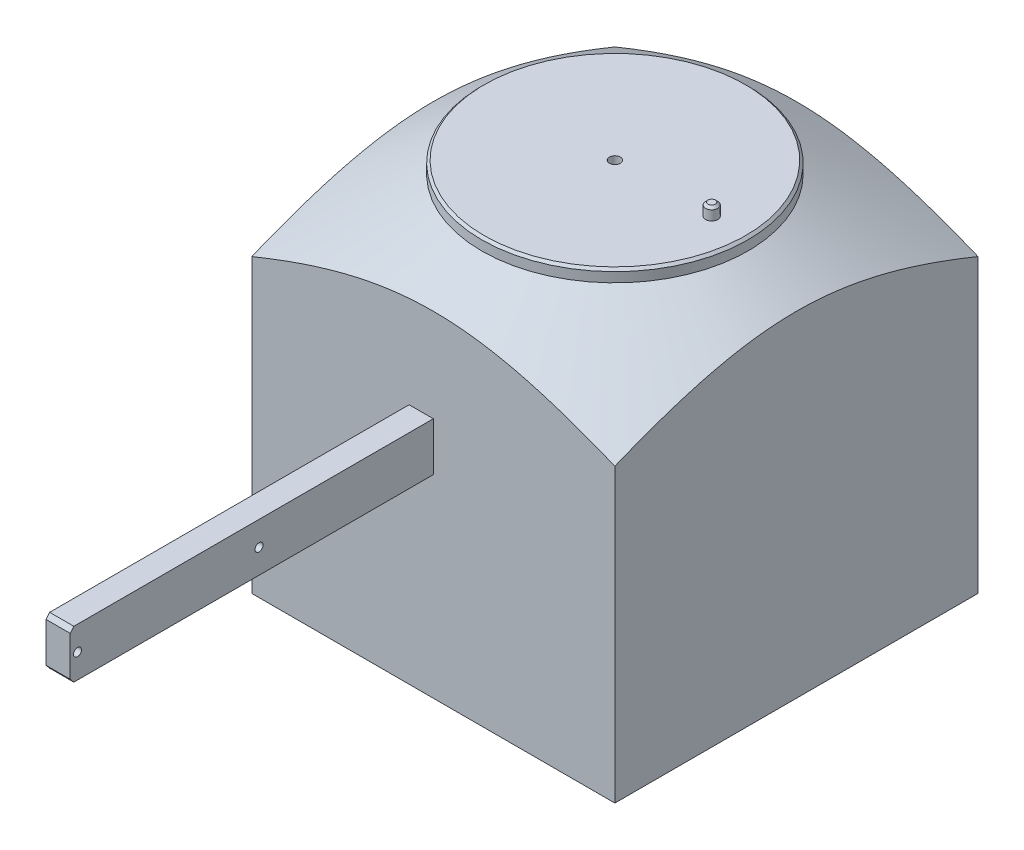
from build123d import *
from OCP.BRepFilletAPI import BRepFilletAPI_MakeChamfer

# Parameters (mm, degrees)
SKETCH1_W                  = 300
SKETCH1_H                  = 300
BOSS_EXTRUDE1_DEPTH        = 300
SKETCH3_R                  = 110
BOSS_EXTRUDE2_DEPTH        = 10
SKETCH4_R                  = 5
BOSS_EXTRUDE3_DEPTH        = 10
CHAMFER1_SIZE              = 2
CHAMFER2_SIZE              = 2
M10X1_0_TAPPED_HOLE1_D     = 9
M10X1_0_TAPPED_HOLE1_DEPTH = 23
M10X1_0_TAPPED_HOLE1_TIP   = 2.703872786
SKETCH7_W                  = 20
SKETCH7_H                  = 40
BOSS_EXTRUDE4_DEPTH        = 300
CHAMFER3_SIZE              = 3
CHAMFER3_SIZE2             = 3.575260778
M6_CLEARANCE_HOLE1_D       = 6.6


with BuildPart() as part:
    # Sketch1 → Boss-Extrude1 (new body)
    with BuildSketch(Plane(origin=(0, 0, 0), x_dir=(1, 0, 0), z_dir=(0, 1, 0))):
        Rectangle(SKETCH1_W, SKETCH1_H)
    extrude(amount=BOSS_EXTRUDE1_DEPTH)

    # Sketch2 → Cut-Revolve1 (revolve, cut)
    with BuildSketch(Plane.XY, mode=Mode.PRIVATE) as cut_revolve1_sk:
        Polygon((110, 300), (250, 219.170962313), (250, 300), align=None)
    revolve(cut_revolve1_sk.sketch.rotate(Axis((0, 394.192122867, 0), (0, -1, 0)), 314.999999708), axis=Axis((0, 394.192122867, 0), (0, -1, 0)), mode=Mode.SUBTRACT)

    # Sketch3 → Boss-Extrude2 (add)
    with BuildSketch(Plane(origin=(0, 300, 0), x_dir=(1, 0, 0), z_dir=(0, 1, 0))):
        with Locations(Location((0, 0, 0), (0, 0, 270))):
            Circle(SKETCH3_R)
    extrude(amount=BOSS_EXTRUDE2_DEPTH)

    # Sketch4 → Boss-Extrude3 (add)
    with BuildSketch(Plane(origin=(0, 310, 0), x_dir=(1, 0, 0), z_dir=(0, 1, 0))):
        with Locations(Location((80, 0, 0), (0, 0, 270))):
            Circle(SKETCH4_R)
    extrude(amount=BOSS_EXTRUDE3_DEPTH)

    # Chamfer1
    chamfer1_edges = [part.edges().sort_by_distance(p)[0] for p in [
        (0, 310, -110),
    ]]
    chamfer(chamfer1_edges, length=CHAMFER1_SIZE)

    # Chamfer2
    chamfer2_edges = [part.edges().sort_by_distance(p)[0] for p in [
        (80, 320, -5),
    ]]
    chamfer(chamfer2_edges, length=CHAMFER2_SIZE)

    # M10x1.0 Tapped Hole1
    with Locations(Plane(origin=(0, 310, 0), x_dir=(1, 0, 0), z_dir=(0, 1, 0))):
        with Locations((0, 0)):
            Hole(M10X1_0_TAPPED_HOLE1_D / 2, depth=M10X1_0_TAPPED_HOLE1_DEPTH)
            with Locations((0, 0, -(M10X1_0_TAPPED_HOLE1_DEPTH + M10X1_0_TAPPED_HOLE1_TIP / 2))):  # 118° drill point
                Cone(0, M10X1_0_TAPPED_HOLE1_D / 2, M10X1_0_TAPPED_HOLE1_TIP, mode=Mode.SUBTRACT)

    # Sketch7 → Boss-Extrude4 (add)
    with BuildSketch(Plane.XY.offset(150)):
        with Locations((-10, 180)):
            Rectangle(SKETCH7_W, SKETCH7_H)
    extrude(amount=BOSS_EXTRUDE4_DEPTH)

    # Chamfer3: one chamfer whose edges measure the first distance from different faces: ONE call of the kernel's chamfer builder (chamfer() names one face for all edges)
    chamfer3_edges_1 = [part.edges().sort_by_distance(p)[0] for p in [
        (-10, 200, 450),
    ]]
    chamfer3_side_1 = [part.faces().sort_by_distance(p)[0] for p in [
        (-10, 200, 300),
    ]]
    chamfer3_edges_2 = [part.edges().sort_by_distance(p)[0] for p in [
        (-10, 160, 450),
    ]]
    chamfer3_side_2 = [part.faces().sort_by_distance(p)[0] for p in [
        (-10, 160, 300),
    ]]
    chamfer3 = BRepFilletAPI_MakeChamfer(part.part.solid().wrapped)
    for e in chamfer3_edges_1:
        chamfer3.Add(CHAMFER3_SIZE, CHAMFER3_SIZE2, e.wrapped, chamfer3_side_1[0].wrapped)  # the first distance lies on this face
    for e in chamfer3_edges_2:
        chamfer3.Add(CHAMFER3_SIZE, CHAMFER3_SIZE2, e.wrapped, chamfer3_side_2[0].wrapped)  # the first distance lies on this face
    add(Compound.cast(chamfer3.Shape()), mode=Mode.REPLACE)

    # M6 Clearance Hole1 (through all)
    with Locations(Plane(origin=(0, 0, 0), x_dir=(0, 0, -1), z_dir=(1, 0, 0))):
        with Locations((-444, 180), (-294, 180)):
            Hole(M6_CLEARANCE_HOLE1_D / 2)


solid = part.part
